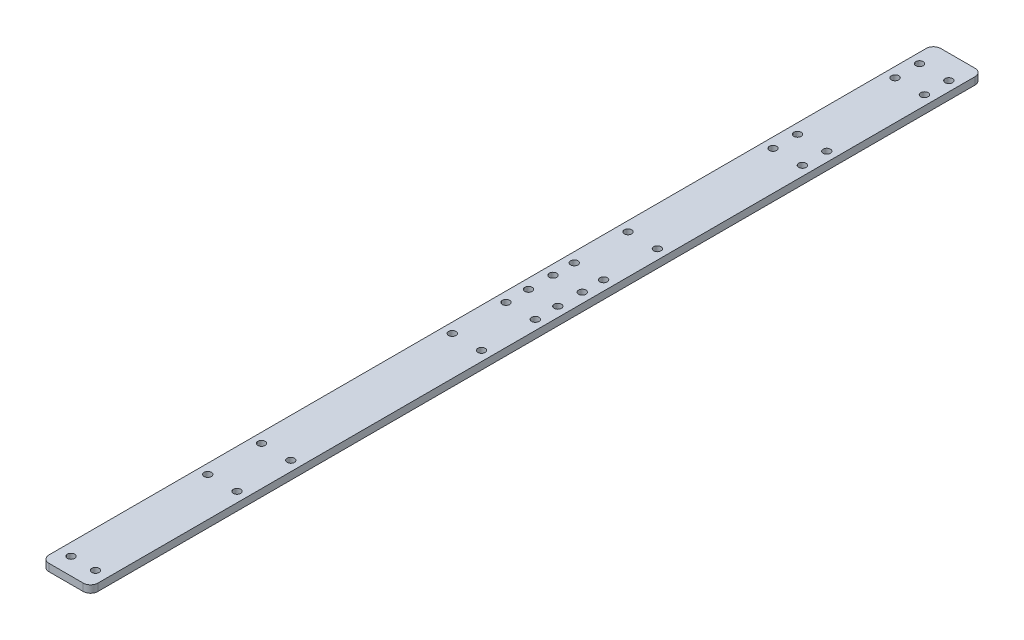
from build123d import *

# Parameters (mm, degrees)
SKETCH_1_W          = 20
SKETCH_1_H          = 510
SKETCH_1_R          = 1.5
EXTRUDE_1_DEPTH     = 3
SKETCH_2_W          = 20
SKETCH_2_H          = 20
CUT_EXTRUDE_1_DEPTH = 257.099704345
SKETCH_3_R          = 1.5
CUT_EXTRUDE_2_DEPTH = 255.347452337
SKETCH_4_W          = 28.97548265
SKETCH_4_H          = 146.861301177
CUT_EXTRUDE_3_DEPTH = 255.347452337
FILLET_1_R          = 3


with BuildPart() as part:
    # 草图1 → 凸台-拉伸1 (new body)
    with BuildSketch(Plane(origin=(0, 0, 0), x_dir=(1, 0, 0), z_dir=(0, 1, 0))):
        with Locations((0.250541192, -0.876894172)):
            Rectangle(SKETCH_1_W, SKETCH_1_H)
        with Locations(Location((5.250541192, -103.876894172, 0), (0, 0, 270))):
            Circle(SKETCH_1_R, mode=Mode.SUBTRACT)
        with Locations(Location((-4.749458808, -103.876894172, 0), (0, 0, 270))):
            Circle(SKETCH_1_R, mode=Mode.SUBTRACT)
        with Locations(Location((6.213384437, -46.87688957, 0), (0, 0, 270))):
            Circle(SKETCH_1_R, mode=Mode.SUBTRACT)
        with Locations(Location((-5.786615563, -46.87688957, 0), (0, 0, 270))):
            Circle(SKETCH_1_R, mode=Mode.SUBTRACT)
        with Locations(Location((6.213384437, -24.87688957, 0), (0, 0, 270))):
            Circle(SKETCH_1_R, mode=Mode.SUBTRACT)
        with Locations(Location((-5.786615563, -24.87688957, 0), (0, 0, 270))):
            Circle(SKETCH_1_R, mode=Mode.SUBTRACT)
        with Locations(Location((6.295138669, 53.123077011, 0), (0, 0, 270))):
            Circle(SKETCH_1_R, mode=Mode.SUBTRACT)
        with Locations(Location((-5.704861331, 53.123077011, 0), (0, 0, 270))):
            Circle(SKETCH_1_R, mode=Mode.SUBTRACT)
        with Locations(Location((6.295138669, 75.123077011, 0), (0, 0, 270))):
            Circle(SKETCH_1_R, mode=Mode.SUBTRACT)
        with Locations(Location((-5.704861331, 75.123077011, 0), (0, 0, 270))):
            Circle(SKETCH_1_R, mode=Mode.SUBTRACT)
        with Locations(Location((6.263384437, 84.37311043, 0), (0, 0, 270))):
            Circle(SKETCH_1_R, mode=Mode.SUBTRACT)
        with Locations(Location((-5.736615563, 84.37311043, 0), (0, 0, 270))):
            Circle(SKETCH_1_R, mode=Mode.SUBTRACT)
        with Locations(Location((6.263384437, 94.37311043, 0), (0, 0, 270))):
            Circle(SKETCH_1_R, mode=Mode.SUBTRACT)
        with Locations(Location((-5.736615563, 94.37311043, 0), (0, 0, 270))):
            Circle(SKETCH_1_R, mode=Mode.SUBTRACT)
        with Locations(Location((6.250541192, 103.123105828, 0), (0, 0, 270))):
            Circle(SKETCH_1_R, mode=Mode.SUBTRACT)
        with Locations(Location((-5.749458808, 103.123105828, 0), (0, 0, 270))):
            Circle(SKETCH_1_R, mode=Mode.SUBTRACT)
        with Locations(Location((6.250541192, 125.123105828, 0), (0, 0, 270))):
            Circle(SKETCH_1_R, mode=Mode.SUBTRACT)
        with Locations(Location((-5.749458808, 125.123105828, 0), (0, 0, 270))):
            Circle(SKETCH_1_R, mode=Mode.SUBTRACT)
        with Locations(Location((6.345138669, 184.373077011, 0), (0, 0, 270))):
            Circle(SKETCH_1_R, mode=Mode.SUBTRACT)
        with Locations(Location((-5.654861331, 184.373077011, 0), (0, 0, 270))):
            Circle(SKETCH_1_R, mode=Mode.SUBTRACT)
        with Locations(Location((6.345138669, 194.373077011, 0), (0, 0, 270))):
            Circle(SKETCH_1_R, mode=Mode.SUBTRACT)
        with Locations(Location((-5.654861331, 194.373077011, 0), (0, 0, 270))):
            Circle(SKETCH_1_R, mode=Mode.SUBTRACT)
        with Locations(Location((6.300541192, 234.373105828, 0), (0, 0, 270))):
            Circle(SKETCH_1_R, mode=Mode.SUBTRACT)
        with Locations(Location((-5.699458808, 234.373105828, 0), (0, 0, 270))):
            Circle(SKETCH_1_R, mode=Mode.SUBTRACT)
        with Locations(Location((6.300541192, 244.373105828, 0), (0, 0, 270))):
            Circle(SKETCH_1_R, mode=Mode.SUBTRACT)
        with Locations(Location((-5.699458808, 244.373105828, 0), (0, 0, 270))):
            Circle(SKETCH_1_R, mode=Mode.SUBTRACT)
    extrude(amount=EXTRUDE_1_DEPTH)

    # 草图2 → 切除-拉伸1 (cut, through all)
    with BuildSketch(Plane(origin=(0, 3, 0), x_dir=(1, 0, 0), z_dir=(0, 1, 0))):
        with Locations((0.250541192, -245.876894172)):
            Rectangle(SKETCH_2_W, SKETCH_2_H)
    extrude(amount=-CUT_EXTRUDE_1_DEPTH, mode=Mode.SUBTRACT)

    # 草图3 → 切除-拉伸2 (cut, through all)
    with BuildSketch(Plane(origin=(0, 3, 0), x_dir=(1, 0, 0), z_dir=(0, 1, 0))):
        with Locations(Location((-5.749458808, -170.876894172, 0), (0, 0, 270))):
            Circle(SKETCH_3_R)
        with Locations(Location((-5.749458808, -200.876894172, 0), (0, 0, 270))):
            Circle(SKETCH_3_R)
        with Locations(Location((6.250541192, -170.876894172, 0), (0, 0, 90))):
            Circle(SKETCH_3_R)
        with Locations(Location((6.250541192, -200.876894172, 0), (0, 0, 90))):
            Circle(SKETCH_3_R)
    extrude(amount=-CUT_EXTRUDE_2_DEPTH, mode=Mode.SUBTRACT)

    # 草图4 → 切除-拉伸3 (cut, through all)
    with BuildSketch(Plane(origin=(0, 3, 0), x_dir=(1, 0, 0), z_dir=(0, 1, 0))):
        with Locations((4.738282517, -184.307544761)):
            Rectangle(SKETCH_4_W, SKETCH_4_H)
    extrude(amount=-CUT_EXTRUDE_3_DEPTH, mode=Mode.SUBTRACT)

    # 圆角1
    fillet_1_edges = [part.edges().sort_by_distance(p)[0] for p in [
        (10.250541192, 1.5, 110.876894172),
        (-9.749458808, 1.5, 110.876894172),
        (10.250541192, 1.5, -254.123105828),
        (-9.749458808, 1.5, -254.123105828),
    ]]
    fillet(fillet_1_edges, radius=FILLET_1_R)


solid = part.part
